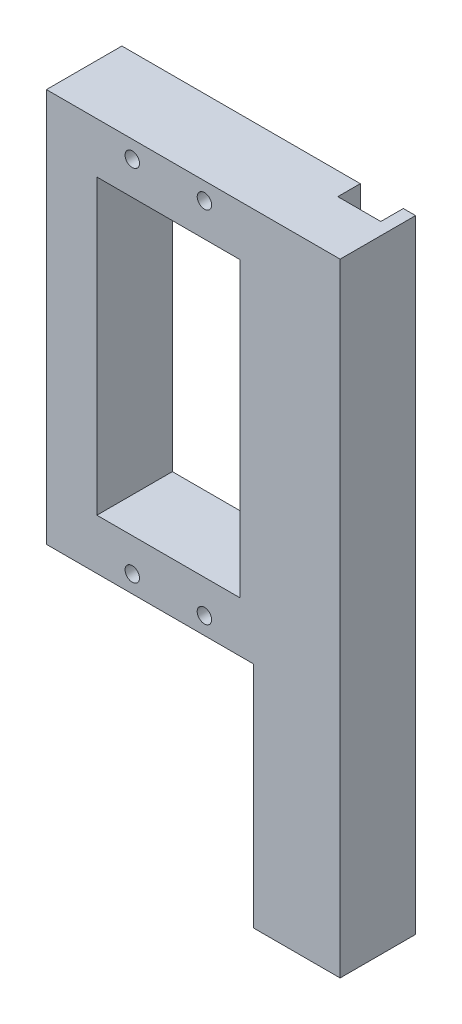
from build123d import *

# Parameters (mm, degrees)
BOSS_EXTRUDE2_DEPTH = 10.46
CUT_EXTRUDE1_DEPTH  = 3.12
SKETCH5_R           = 1
CUT_EXTRUDE2_DEPTH  = 20
SKETCH6_W           = 101.62658131
SKETCH6_H           = 95.645321602
CUT_EXTRUDE3_DEPTH  = 30


with BuildPart() as part:
    # Sketch2 → Boss-Extrude2 (new body)
    with BuildSketch(Plane.XY):
        Polygon((-7.9, 27.3), (23.813102619, 27.3), (23.813102619, -59.002149985), (11.813102619, -59.002149985), (11.813102619, -27.3), (-2.175, -27.3), (-16.9, -27.3), (-16.9, 27.3), align=None)
        Polygon((-9.9, -20.3), (9.9, -20.3), (9.9, -19.3), (9.9, 20.3), (-9.9, 20.3), align=None, mode=Mode.SUBTRACT)
    extrude(amount=BOSS_EXTRUDE2_DEPTH)

    # Sketch4 → Cut-Extrude1 (cut)
    with BuildSketch(Plane.XY.offset(10.46)):
        Polygon((17.813102619, -59.002149985), (17.2, -59.002149985), (16.150910181, -59.002149985), (16.150910181, 27.3), (17.2, 27.3), (22.113102619, 27.3), (22.113102619, -59.002149985), align=None)
    extrude(amount=-CUT_EXTRUDE1_DEPTH, mode=Mode.SUBTRACT)

    # Sketch5 → Cut-Extrude2 (cut)
    with BuildSketch(Plane.XY.offset(10.46)):
        with Locations((-5, -24.9)):
            Circle(SKETCH5_R)
        with Locations((5, -24.9)):
            Circle(SKETCH5_R)
        with Locations((-5, 24.89)):
            Circle(SKETCH5_R)
        with Locations((5, 24.89)):
            Circle(SKETCH5_R)
    extrude(amount=-CUT_EXTRUDE2_DEPTH, mode=Mode.SUBTRACT)


with BuildPart() as body_2:
    # Mirror1: mirrored copy
    add(part.part.mirror(Plane(origin=(0, 0, -10), x_dir=(1, 0, 0), z_dir=(0, 0, -1))))


with BuildPart() as part_1:
    add(part.part)

    # Sketch6 → Cut-Extrude3 (cut)
    with BuildSketch(Plane(origin=(0, 0, 0), x_dir=(-1, 0, 0), z_dir=(0, 0, -1))):
        with Locations((27.000188036, -20.522660801)):
            Rectangle(SKETCH6_W, SKETCH6_H)
    extrude(amount=-CUT_EXTRUDE3_DEPTH, mode=Mode.SUBTRACT)


solid = body_2.part
